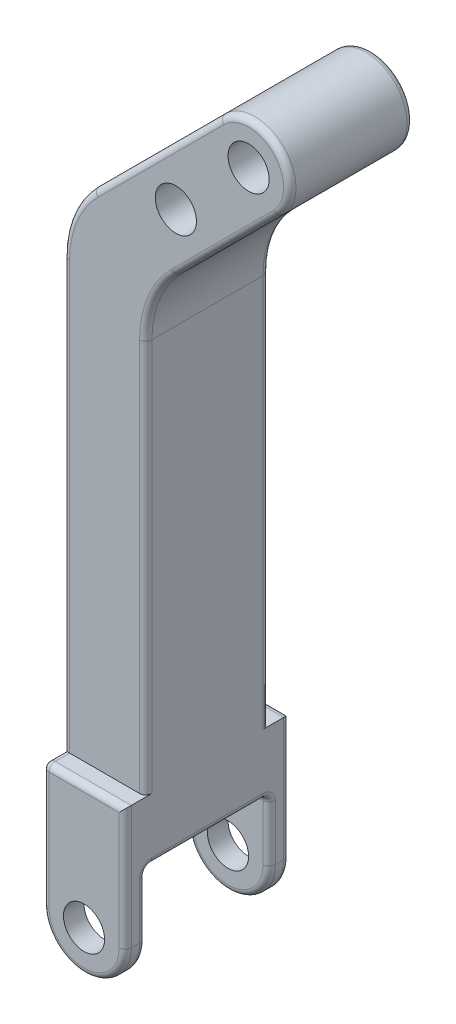
from build123d import *

# Parameters (mm, degrees)
SKETCH_1_R          = 20
SKETCH_1_R_2        = 10
EXTRUDE_1_DEPTH     = 60
EXTRUDE_2_DEPTH     = 30
SKETCH_4_R          = 10
EXTRUDE_3_DEPTH     = 10
SKETCH_8_R          = 10
CUT_EXTRUDE_1_DEPTH = 100
FILLET_1_R          = 50
FILLET_2_R          = 3


with BuildPart() as part:
    # 草图1 → 凸台-拉伸1 (new body)
    with BuildSketch(Plane.XY):
        Circle(SKETCH_1_R)
        Circle(SKETCH_1_R_2, mode=Mode.SUBTRACT)
    extrude(amount=EXTRUDE_1_DEPTH)

    # 草图2 → 凸台-拉伸2 (add, symmetric)
    with BuildSketch(Plane.XY.offset(30)):
        with BuildLine():
            Line((-14.142135624, 14.142135624), (-90, -61.715728753))
            Line((-90, -61.715728753), (-90, -320))
            Line((-90, -320), (-50, -320))
            Line((-50, -320), (-50, -78.284271247))
            Line((-50, -78.284271247), (14.142135624, -14.142135624))
            ThreePointArc((14.142135624, -14.142135624), (-14.142135624, -14.142135624), (-14.142135624, 14.142135624))
        make_face()
    extrude(amount=EXTRUDE_2_DEPTH, both=True)

    # 草图4 → 凸台-拉伸3 (add)
    with BuildSketch(Plane.XY.offset(60)):
        with BuildLine():
            Line((-90, -290), (-50, -290))
            Line((-50, -290), (-50, -350))
            ThreePointArc((-50, -350), (-70, -370), (-90, -350))
            Line((-90, -350), (-90, -290))
        make_face()
        with Locations((-70, -350)):
            Circle(SKETCH_4_R, mode=Mode.SUBTRACT)
    extrude_3 = extrude(amount=EXTRUDE_3_DEPTH)

    # 镜向1: 凸台-拉伸3 across plane
    add(extrude_3.mirror(Plane.XY.offset(30)))

    # 草图8 → 切除-拉伸1 (cut)
    with BuildSketch(Plane.XY.offset(60)):
        with Locations((-35.355339059, -35.355339059)):
            Circle(SKETCH_8_R)
    extrude(amount=-CUT_EXTRUDE_1_DEPTH, mode=Mode.SUBTRACT)

    # 圆角1
    fillet_1_edges = [part.edges().sort_by_distance(p)[0] for p in [
        (-50, -78.284271247, 30),
        (-90, -61.715728753, 30),
    ]]
    fillet(fillet_1_edges, radius=FILLET_1_R)

    # 圆角2
    fillet_2_edges = [part.edges().sort_by_distance(p)[0] for p in [
        (14.142135624, 14.142135624, 60),
        (14.142135624, 14.142135624, 0),
        (-10.606601718, -38.890872965, 60),
        (-44.748737342, -16.464466094, 0),
        (-70, -320, 0),
        (-90, -320, 30),
        (-50, -320, 30),
        (-44.748737342, -16.464466094, 60),
        (-70, -320, 60),
        (-10.606601718, -38.890872965, 0),
        (-90, -320, 70),
        (-70, -370, 70),
        (-50, -320, 70),
        (-70, -290, 70),
        (-90, -335, 60),
        (-90, -290, 65),
        (-70, -370, 60),
        (-50, -335, 60),
        (-90, -320, -10),
        (-70, -290, -10),
        (-90, -290, -5),
        (-50, -320, -10),
        (-70, -370, -10),
        (-90, -335, 0),
        (-70, -370, 0),
        (-50, -335, 0),
        (-90, -186.213203436, 0),
        (-90, -186.213203436, 60),
        (-50, -194.497474683, 0),
        (-86.193976626, -63.292235253, 0),
        (-50, -194.497474683, 60),
        (-86.193976626, -63.292235253, 60),
        (-46.193976626, -79.860777748, 0),
        (-46.193976626, -79.860777748, 60),
    ]]
    fillet(fillet_2_edges, radius=FILLET_2_R)


solid = part.part
